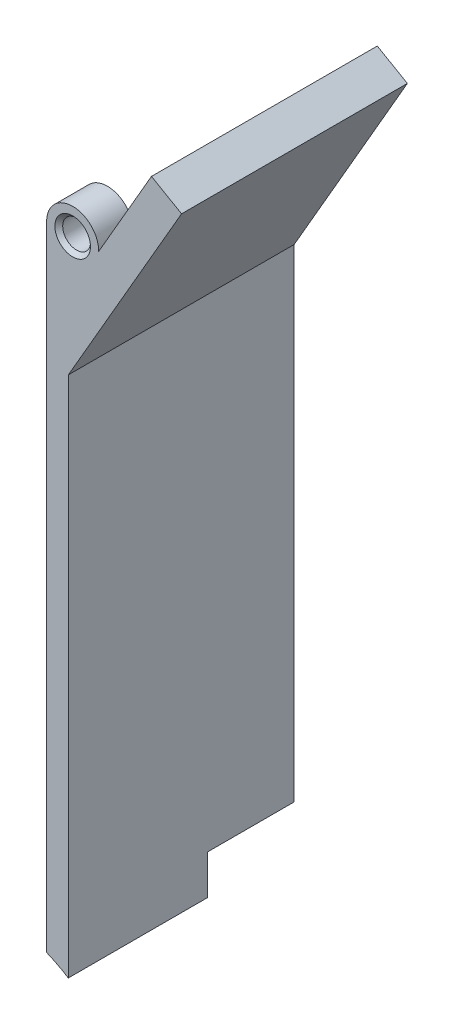
from build123d import *

# Parameters (mm, degrees)
EXTRUDE_START                = -2
EXTRUDE_1_DEPTH              = 13
SKETCH_2_R                   = 11
CUT_EXTRUDE_1_DEPTH          = 5
SKETCH_3_R                   = 1.5
EXTRUDE_2_DEPTH              = 2
EXTRUDE_3_DEPTH              = 2
HOLE_WIZARD_M2_4_D           = 1.6
HOLE_WIZARD_M2_4_DEPTH       = 5.2
HOLE_WIZARD_M2_4_CSINK_D     = 2.05
HOLE_WIZARD_M2_4_CSINK_ANGLE = 90
HOLE_WIZARD_M2_4_TIP         = 0.480688495
HOLE_WIZARD_M2_5_D           = 1.6
HOLE_WIZARD_M2_5_DEPTH       = 5.2
HOLE_WIZARD_M2_5_CSINK_D     = 2.05
HOLE_WIZARD_M2_5_CSINK_ANGLE = 90
HOLE_WIZARD_M2_5_TIP         = 0.480688495


with BuildPart() as part:
    # 草图1 → 凸台-拉伸1 (new body)
    with BuildSketch(Plane.XY.offset(EXTRUDE_START)):
        with BuildLine():
            Line((2.570888862, -12.45291013), (-3.464101615, -2))
            Line((-3.464101615, -2), (-5.196152423, -3))
            Line((-5.196152423, -3), (1.320888862, -14.287846621))
            Line((1.320888862, -14.287846621), (1.320888862, -44.355557574))
            ThreePointArc((1.320888862, -44.355557574), (1.933218512, -44.007523283), (2.570888862, -43.708438024))
            Line((2.570888862, -43.708438024), (2.570888862, -12.45291013))
        make_face()
    extrude(amount=-EXTRUDE_1_DEPTH)

    # 草图2 → 切除-拉伸1 (cut)
    with BuildSketch(Plane(origin=(0, 0, -15), x_dir=(-1, 0, 0), z_dir=(0, 0, -1))):
        with Locations((-6.070888862, -52)):
            Circle(SKETCH_2_R)
    extrude(amount=-CUT_EXTRUDE_1_DEPTH, mode=Mode.SUBTRACT)

    # 草图3 → 凸台-拉伸2 (add)
    with BuildSketch(Plane(origin=(0, 0, -15), x_dir=(-1, 0, 0), z_dir=(0, 0, -1))):
        with Locations((-4.070888862, -39.661037321)):
            Circle(SKETCH_3_R)
        with BuildLine():
            Line((-2.570888862, -41.571673193), (-2.570888862, -39.661037321))
            ThreePointArc((-2.570888862, -39.661037321), (-3.098777733, -40.803403266), (-4.310888798, -41.141712853))
            ThreePointArc((-4.310888798, -41.141712853), (-3.432117057, -41.321194666), (-2.570888862, -41.571673193))
        make_face()
        with BuildLine():
            Line((-2.570888862, -39.661037321), (-2.570888862, -38.161037321))
            Line((-2.570888862, -38.161037321), (-4.070888862, -38.161037321))
            ThreePointArc((-4.070888862, -38.161037321), (-3.010228691, -38.600377149), (-2.570888862, -39.661037321))
        make_face()
    extrude(amount=-EXTRUDE_2_DEPTH)

    # 草图4 → 凸台-拉伸3 (add)
    with BuildSketch(Plane.XY.offset(-2)):
        with BuildLine():
            Line((0.320888862, -8.555795813), (2.570888862, -12.45291013))
            Line((2.570888862, -12.45291013), (2.570888862, -7.256757708))
            ThreePointArc((2.570888862, -7.256757708), (1.820888862, -8.555795813), (0.320888862, -8.555795813))
        make_face()
        with BuildLine():
            ThreePointArc((0.320888862, -8.555795813), (1.820888862, -8.555795813), (2.570888862, -7.256757708))
            Line((2.570888862, -7.256757708), (-0.429111138, -7.256757708))
            Line((-0.429111138, -7.256757708), (0.320888862, -8.555795813))
        make_face()
        with BuildLine():
            Line((-0.429111138, -7.256757708), (2.570888862, -7.256757708))
            ThreePointArc((2.570888862, -7.256757708), (1.070888862, -5.756757708), (-0.429111138, -7.256757708))
        make_face()
    extrude(amount=-EXTRUDE_3_DEPTH)

    # M2 螺纹孔4
    with Locations(Plane.XY.offset(-2)):
        with Locations((1.070888862, -7.256757708)):
            CounterSinkHole(HOLE_WIZARD_M2_4_D / 2, HOLE_WIZARD_M2_4_CSINK_D / 2, depth=HOLE_WIZARD_M2_4_DEPTH, counter_sink_angle=HOLE_WIZARD_M2_4_CSINK_ANGLE)
            with Locations((0, 0, -(HOLE_WIZARD_M2_4_DEPTH + HOLE_WIZARD_M2_4_TIP / 2))):  # 118° drill point
                Cone(0, HOLE_WIZARD_M2_4_D / 2, HOLE_WIZARD_M2_4_TIP, mode=Mode.SUBTRACT)

    # M2 螺纹孔5
    with Locations(Plane(origin=(0, 0, -15), x_dir=(-1, 0, 0), z_dir=(0, 0, -1))):
        with Locations((-4.070888862, -39.661037321)):
            CounterSinkHole(HOLE_WIZARD_M2_5_D / 2, HOLE_WIZARD_M2_5_CSINK_D / 2, depth=HOLE_WIZARD_M2_5_DEPTH, counter_sink_angle=HOLE_WIZARD_M2_5_CSINK_ANGLE)
            with Locations((0, 0, -(HOLE_WIZARD_M2_5_DEPTH + HOLE_WIZARD_M2_5_TIP / 2))):  # 118° drill point
                Cone(0, HOLE_WIZARD_M2_5_D / 2, HOLE_WIZARD_M2_5_TIP, mode=Mode.SUBTRACT)


with BuildPart() as body_2:
    # 镜向2: mirrored copy
    add(part.part.mirror(Plane(origin=(31.372793256, 0, 0), x_dir=(0, 0, 1), z_dir=(1, 0, 0))))


solid = body_2.part
